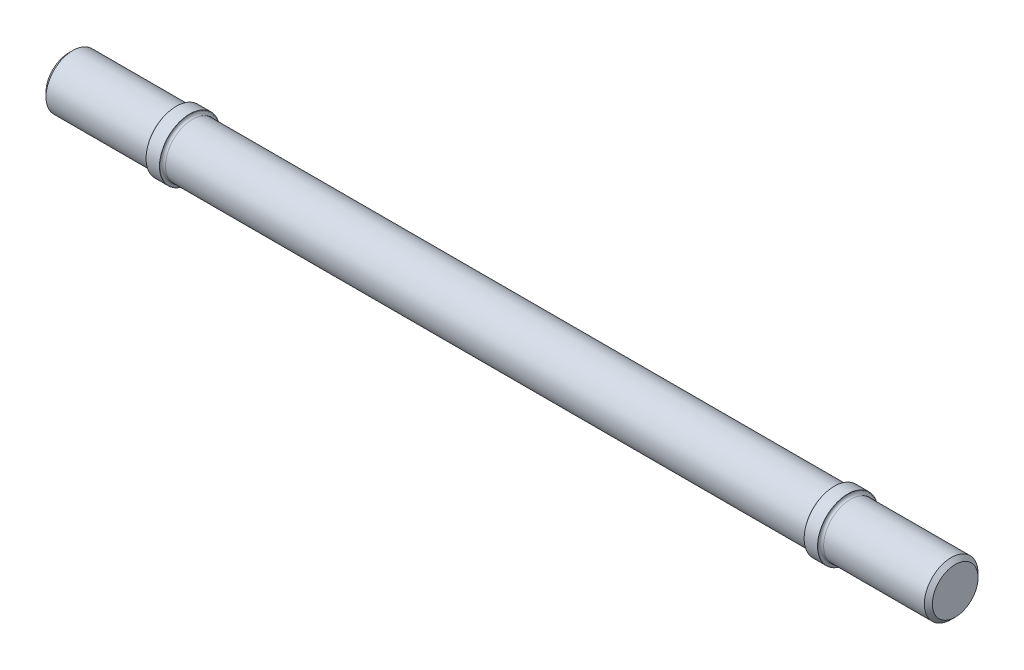
from build123d import *

# Parameters (mm, degrees)
SKETCH2_W     = 8
SKETCH2_H     = 2
SKETCH2_W_2   = 24
FILLET1_R     = 0.2
CHAMFER1_SIZE = 0.3


with BuildPart() as part:
    # Sketch2 → Revolve1 (revolve)
    with BuildSketch(Plane.XY, mode=Mode.PRIVATE) as revolve1_sk:
        with Locations((4, 1)):
            Rectangle(SKETCH2_W, SKETCH2_H)
        with Locations((14, 1)):
            Rectangle(SKETCH2_W, SKETCH2_H)
        Polygon((8, 2.25), (8, 2), (8, 0), (10, 0), (10, 2), (9, 2), (9, 2.25), align=None)
        with Locations((30, 1)):
            Rectangle(SKETCH2_W_2, SKETCH2_H)
        with Locations((46, 1)):
            Rectangle(SKETCH2_W, SKETCH2_H)
        Polygon((50, 2), (50, 0), (58, 0), (58, 2), (58, 2.25), (57, 2.25), (57, 2), align=None)
        with Locations((62, 1)):
            Rectangle(SKETCH2_W, SKETCH2_H)
    revolve(revolve1_sk.sketch.rotate(Axis((0, 0, 0), (1, 0, 0)), 90), axis=Axis((0, 0, 0), (1, 0, 0)))

    # Fillet1
    fillet1_edges = [part.edges().sort_by_distance(p)[0] for p in [
        (8, 0, -2),
        (9, 0, -2),
        (57, 0, -2),
        (58, 0, -2),
    ]]
    fillet(fillet1_edges, radius=FILLET1_R)

    # Chamfer1
    chamfer1_edges = [part.edges().sort_by_distance(p)[0] for p in [
        (0, 0, -2),
        (66, 0, -2),
    ]]
    chamfer(chamfer1_edges, length=CHAMFER1_SIZE)


solid = part.part
